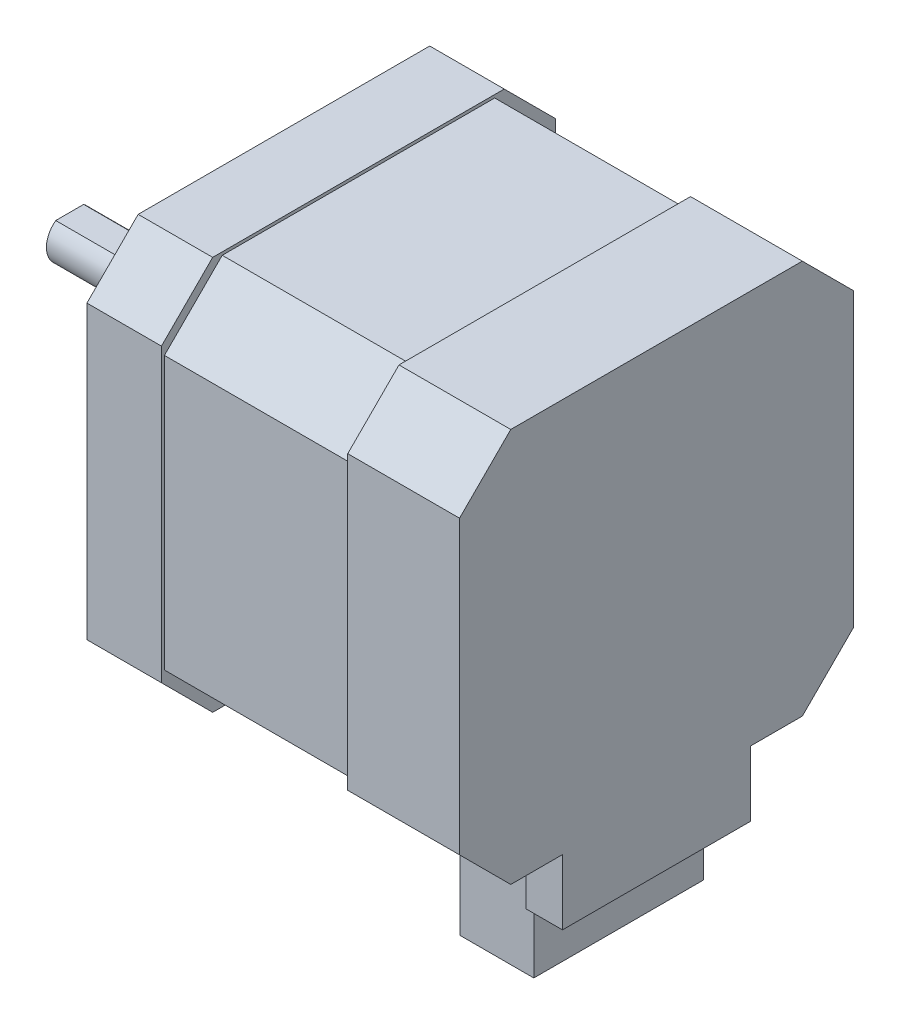
from build123d import *

# Parameters (mm, degrees)
SKETCH1_R           = 1.5
BOSS_EXTRUDE1_DEPTH = 40
SKETCH1_3_R         = 1.5
CUT_EXTRUDE1_DEPTH  = 4
SKETCH3_R           = 11
SKETCH3_R_2         = 2.5
BOSS_EXTRUDE2_DEPTH = 2
SKETCH3_3_R         = 2.5
BOSS_EXTRUDE3_DEPTH = 23
CUT_EXTRUDE2_START  = -18
CUT_EXTRUDE2_DEPTH  = 18
CUT_EXTRUDE4_START  = -12
SKETCH5_W           = 55.059471924
SKETCH5_H           = 55.059471924
CUT_EXTRUDE4_DEPTH  = 20
SKETCH6_W           = 7.933477793
SKETCH6_H           = 18.223329292
BOSS_EXTRUDE4_DEPTH = 14
SKETCH7_W           = 3.936196897
SKETCH7_H           = 20.200423078
BOSS_EXTRUDE5_DEPTH = 7


with BuildPart() as part:
    # Sketch1 → Boss-Extrude1 (new body)
    # profile 1 of 5: a face of its own
    with BuildSketch(Plane(origin=(0, 0, 0), x_dir=(0, 0, -1), z_dir=(1, 0, 0))):
        Polygon((-15.65, 21.15), (0, 21.15), (15.65, 21.15), (21.15, 15.65), (21.15, 0), (21.15, -15.65), (15.65, -21.15), (0, -21.15), (-15.65, -21.15), (-21.15, -15.65), (-21.15, 0), (-21.15, 15.65), align=None)
        with Locations((-15.5, 15.5)):
            Circle(SKETCH1_R, mode=Mode.SUBTRACT)
        with Locations((-15.5, -15.5)):
            Circle(SKETCH1_R, mode=Mode.SUBTRACT)
        with Locations((15.5, -15.5)):
            Circle(SKETCH1_R, mode=Mode.SUBTRACT)
        with Locations((15.5, 15.5)):
            Circle(SKETCH1_R, mode=Mode.SUBTRACT)
    # profile 2 of 5: a face of its own
    with BuildSketch(Plane(origin=(0, 0, 0), x_dir=(0, 0, -1), z_dir=(1, 0, 0))):
        with Locations((15.5, -15.5)):
            Circle(SKETCH1_R)
    # profile 3 of 5: a face of its own
    with BuildSketch(Plane(origin=(0, 0, 0), x_dir=(0, 0, -1), z_dir=(1, 0, 0))):
        with Locations((-15.5, -15.5)):
            Circle(SKETCH1_R)
    # profile 4 of 5: a face of its own
    with BuildSketch(Plane(origin=(0, 0, 0), x_dir=(0, 0, -1), z_dir=(1, 0, 0))):
        with Locations((-15.5, 15.5)):
            Circle(SKETCH1_R)
    # profile 5 of 5: a face of its own
    with BuildSketch(Plane(origin=(0, 0, 0), x_dir=(0, 0, -1), z_dir=(1, 0, 0))):
        with Locations((15.5, 15.5)):
            Circle(SKETCH1_R)
    extrude(amount=BOSS_EXTRUDE1_DEPTH)

    # Sketch1<3> → Cut-Extrude1 (cut)
    with BuildSketch(Plane(origin=(0, 0, 0), x_dir=(0, 0, -1), z_dir=(1, 0, 0))):
        with Locations((-15.5, 15.5)):
            Circle(SKETCH1_3_R)
        with Locations((15.5, -15.5)):
            Circle(SKETCH1_3_R)
        with Locations((-15.5, -15.5)):
            Circle(SKETCH1_3_R)
        with Locations((15.5, 15.5)):
            Circle(SKETCH1_3_R)
    extrude(amount=CUT_EXTRUDE1_DEPTH, mode=Mode.SUBTRACT)

    # Sketch3 → Boss-Extrude2 (add)
    with BuildSketch(Plane.ZY):
        Circle(SKETCH3_R)
        Circle(SKETCH3_R_2, mode=Mode.SUBTRACT)
    extrude(amount=BOSS_EXTRUDE2_DEPTH)

    # Sketch3<3> → Boss-Extrude3 (add)
    with BuildSketch(Plane.ZY):
        Circle(SKETCH3_3_R)
    extrude(amount=BOSS_EXTRUDE3_DEPTH)

    # Sketch4 → Cut-Extrude2 (cut)
    with BuildSketch(Plane.ZY.offset(23).offset(CUT_EXTRUDE2_START)):
        with BuildLine():
            Line((-1.5, 2), (1.5, 2))
            ThreePointArc((1.5, 2), (0, 2.5), (-1.5, 2))
        make_face()
    extrude(amount=CUT_EXTRUDE2_DEPTH, mode=Mode.SUBTRACT)

    # Sketch5 → Cut-Extrude4 (cut)
    with BuildSketch(Plane(origin=(40, 0, 0), x_dir=(0, 0, -1), z_dir=(1, 0, 0)).offset(CUT_EXTRUDE4_START)):
        Rectangle(SKETCH5_W, SKETCH5_H)
        Polygon((-20.829250382, 14.625463373), (-14.625463373, 20.829250382), (14.625463373, 20.829250382), (20.829250382, 14.625463373), (20.829250382, -14.625463373), (14.625463373, -20.829250382), (-14.625463373, -20.829250382), (-20.829250382, -14.625463373), align=None, mode=Mode.SUBTRACT)
    extrude(amount=-CUT_EXTRUDE4_DEPTH, mode=Mode.SUBTRACT)

    # Sketch6 → Boss-Extrude4 (add)
    with BuildSketch(Plane.XZ.offset(21.15)):
        with Locations((31.966738897, 0)):
            Rectangle(SKETCH6_W, SKETCH6_H)
    extrude(amount=BOSS_EXTRUDE4_DEPTH)

    # Sketch7 → Boss-Extrude5 (add)
    with BuildSketch(Plane.XZ.offset(21.15)):
        with Locations((38.031901551, 0)):
            Rectangle(SKETCH7_W, SKETCH7_H)
    extrude(amount=BOSS_EXTRUDE5_DEPTH)


solid = part.part
